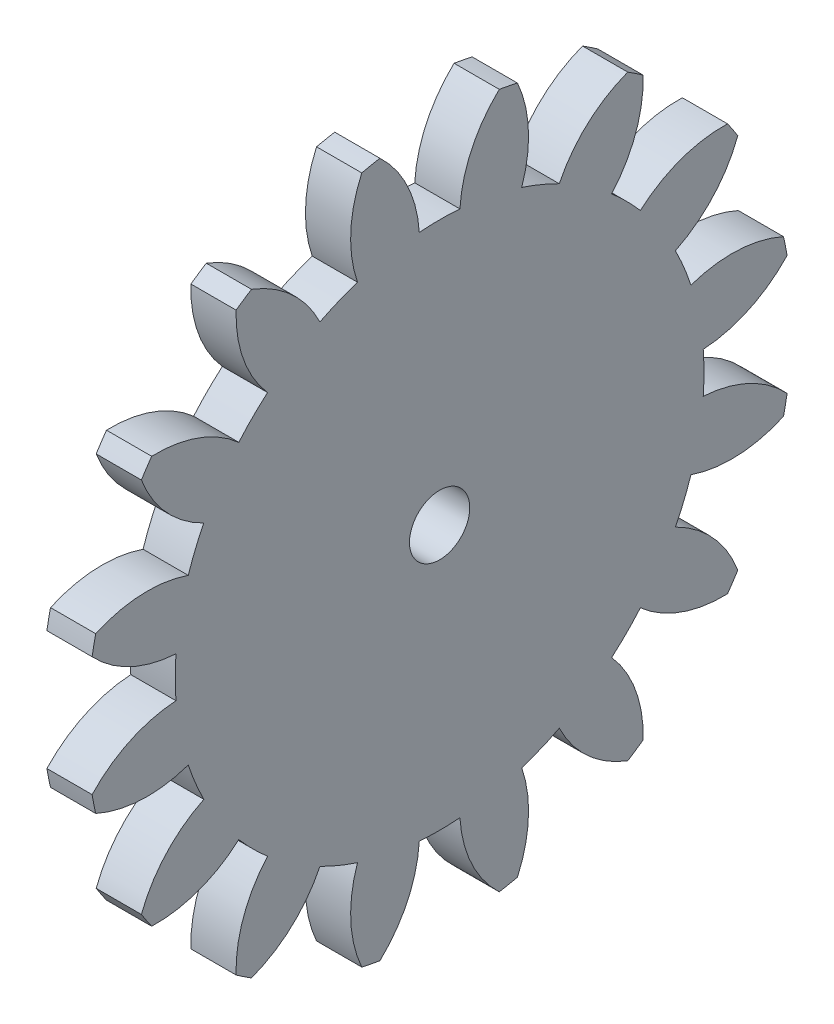
from build123d import *

# Parameters (mm, degrees)
BASPROSKE_W     = 1.5
BASPROSKE_H     = 11.7
TOOTHCUT_DEPTH  = 17.614150595
TEETHCUTS_COUNT = 16
TEETHCUTS_ANGLE = 337.5
BORSKE_R        = 1
BORE_DEPTH      = 50.0000508


with BuildPart() as part:
    # BasProSke → Base-Revolve (revolve)
    with BuildSketch(Plane(origin=(0, 0, 0), x_dir=(1, 0, 0), z_dir=(0, 1, 0)), mode=Mode.PRIVATE) as base_revolve_sk:
        with Locations((0.75, 5.85)):
            Rectangle(BASPROSKE_W, BASPROSKE_H)
    revolve(base_revolve_sk.sketch.rotate(Axis((-10, 0, 0), (1, 0, 0)), 180), axis=Axis((-10, 0, 0), (1, 0, 0)))

    # TooCutSke → ToothCut (cut, through all)
    with BuildSketch(Plane(origin=(0, 0, 0), x_dir=(0, 0, -1), z_dir=(1, 0, 0))):
        with BuildLine():
            ThreePointArc((0.674445932, 8.748039705), (0, 8.774), (-0.674445932, 8.748039705))
            ThreePointArc((-0.674445932, 8.748039705), (-1.067677415, 10.27910326), (-2.003709632, 11.552928324))
            ThreePointArc((-2.003709632, 11.552928324), (0, 11.7254), (2.003709632, 11.552928324))
            ThreePointArc((2.003709632, 11.552928324), (1.067677415, 10.27910326), (0.674445932, 8.748039705))
        make_face()
    toothcut = extrude(amount=TOOTHCUT_DEPTH, mode=Mode.SUBTRACT)

    # TeethCuts: ToothCut ×16 about axis
    teethcuts_axis = Axis((-10, 0, 0), (1, 0, 0))
    for i in range(1, TEETHCUTS_COUNT):
        add(toothcut.rotate(teethcuts_axis, i * TEETHCUTS_ANGLE / (TEETHCUTS_COUNT - 1)), mode=Mode.SUBTRACT)

    # BorSke → Bore (cut, symmetric)
    with BuildSketch(Plane(origin=(0, 0, 0), x_dir=(0, 0, -1), z_dir=(1, 0, 0))):
        with Locations(Location((0, 0, 0), (0, 0, 180))):
            Circle(BORSKE_R)
    extrude(amount=BORE_DEPTH, both=True, mode=Mode.SUBTRACT)


solid = part.part
